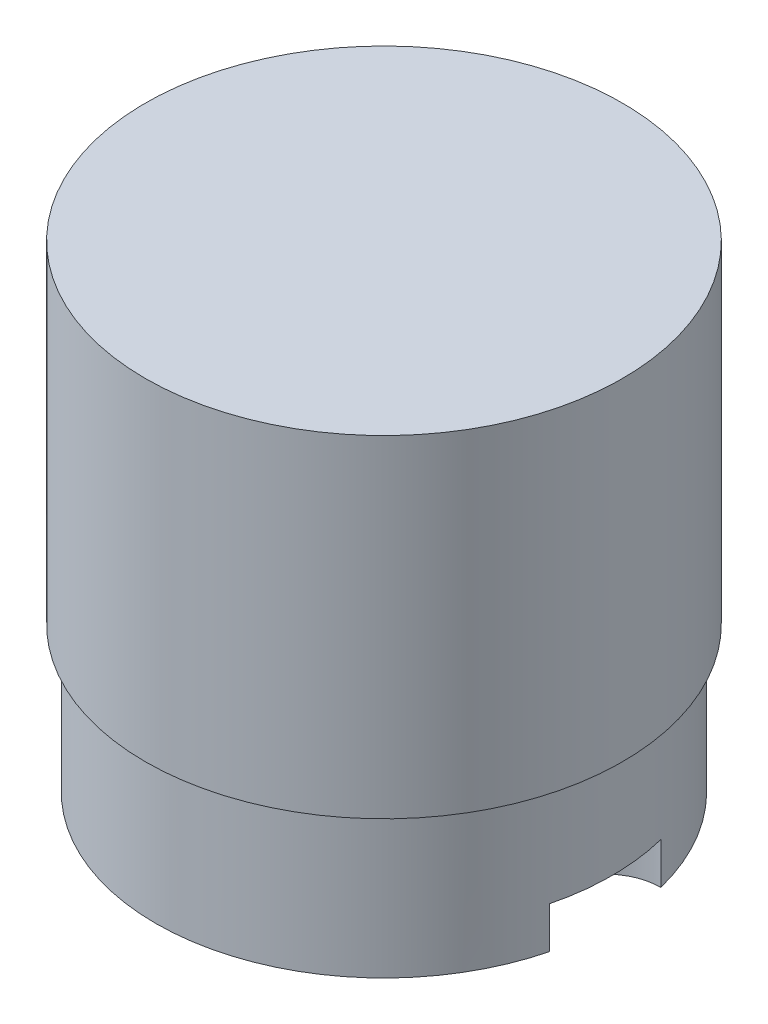
from build123d import *

# Parameters (mm, degrees)
SKETCH2_W           = 0.35
SKETCH2_H           = 1.25
CUT_EXTRUDE1_DEPTH  = 1
SKETCH3_W           = 1.5
SKETCH3_H           = 0.25
BOSS_EXTRUDE1_DEPTH = 0.25


with BuildPart() as part:
    # Sketch1 → Revolve1 (revolve)
    with BuildSketch(Plane(origin=(0, 0, 0), x_dir=(0, 0, -1), z_dir=(1, 0, 0))):
        Polygon((0, 5.75), (-5.75, 5.75), (-5.75, -2.25), (-5.5, -2.25), (-5.5, -5.75), (0, -5.75), align=None)
    revolve(axis=Axis((0, 5.75, 0), (0, -1, 0)))

    # Sketch2 → Cut-Extrude1 (cut)
    with BuildSketch(Plane.XZ.offset(5.75)):
        with Locations((0, -1.875)):
            Rectangle(SKETCH2_W, SKETCH2_H)
        with Locations((2.8, 1.875)):
            Rectangle(SKETCH2_W, SKETCH2_H)
        with Locations((0, 1.875)):
            Rectangle(SKETCH2_W, SKETCH2_H)
        with Locations((2.8, -1.875)):
            Rectangle(SKETCH2_W, SKETCH2_H)
        with Locations((-2.8, -1.875)):
            Rectangle(SKETCH2_W, SKETCH2_H)
        with Locations((-2.8, 1.875)):
            Rectangle(SKETCH2_W, SKETCH2_H)
        with BuildLine():
            ThreePointArc((5.334266585, 1.34), (3.994266585, 0), (5.334266585, -1.34))
            ThreePointArc((5.334266585, -1.34), (5.5, 0), (5.334266585, 1.34))
        make_face()
        with BuildLine():
            ThreePointArc((-5.334266585, 1.34), (-3.994266585, 0), (-5.334266585, -1.34))
            ThreePointArc((-5.334266585, -1.34), (-5.5, 0), (-5.334266585, 1.34))
        make_face()
    extrude(amount=-CUT_EXTRUDE1_DEPTH, mode=Mode.SUBTRACT)

    # Sketch3 → Boss-Extrude1 (add)
    with BuildSketch(Plane.XZ.offset(5.75)):
        Polygon((1.25, -0.125), (1.875, -0.125), (1.875, -0.75), (2.125, -0.75), (2.125, -0.125), (2.75, -0.125), (2.75, 0.125), (2.125, 0.125), (2.125, 0.75), (1.875, 0.75), (1.875, 0.125), (1.25, 0.125), align=None)
        with Locations((-2, 0)):
            Rectangle(SKETCH3_W, SKETCH3_H)
    extrude(amount=BOSS_EXTRUDE1_DEPTH)


solid = part.part
